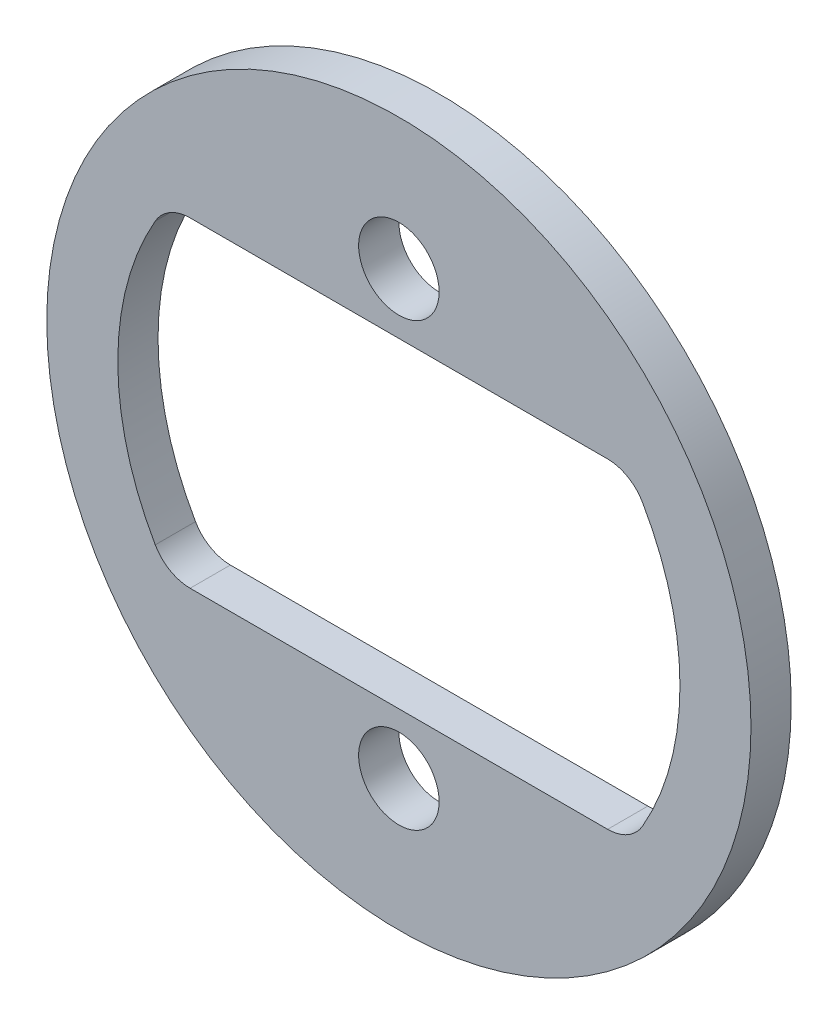
from build123d import *

# Parameters (mm, degrees)
SKETCH1_R           = 17.5
SKETCH1_R_2         = 13.97
SKETCH1_R_3         = 2
BOSS_EXTRUDE1_DEPTH = 2
FILLET1_R           = 2


with BuildPart() as part:
    # Sketch1 → Boss-Extrude1 (new body)
    # profile 1 of 3: a face of its own
    with BuildSketch(Plane.XY):
        Circle(SKETCH1_R)
        Circle(SKETCH1_R_2, mode=Mode.SUBTRACT)
    # profile 2 of 3: a face of its own
    with BuildSketch(Plane.XY):
        with BuildLine():
            Line((11.473447607, -7.97), (-11.473447607, -7.97))
            ThreePointArc((-11.473447607, -7.97), (0, -13.97), (11.473447607, -7.97))
        make_face()
        with Locations((0, -10.97)):
            Circle(SKETCH1_R_3, mode=Mode.SUBTRACT)
    # profile 3 of 3: a face of its own
    with BuildSketch(Plane.XY):
        with BuildLine():
            Line((-11.473447607, 7.97), (11.473447607, 7.97))
            ThreePointArc((11.473447607, 7.97), (0, 13.97), (-11.473447607, 7.97))
        make_face()
        with Locations((0, 10.97)):
            Circle(SKETCH1_R_3, mode=Mode.SUBTRACT)
    extrude(amount=BOSS_EXTRUDE1_DEPTH)

    # Fillet1
    fillet1_edges = [part.edges().sort_by_distance(p)[0] for p in [
        (11.473447607, -7.97, 1),
        (11.473447607, 7.97, 1),
        (-11.473447607, 7.97, 1),
        (-11.473447607, -7.97, 1),
    ]]
    fillet(fillet1_edges, radius=FILLET1_R)


solid = part.part
